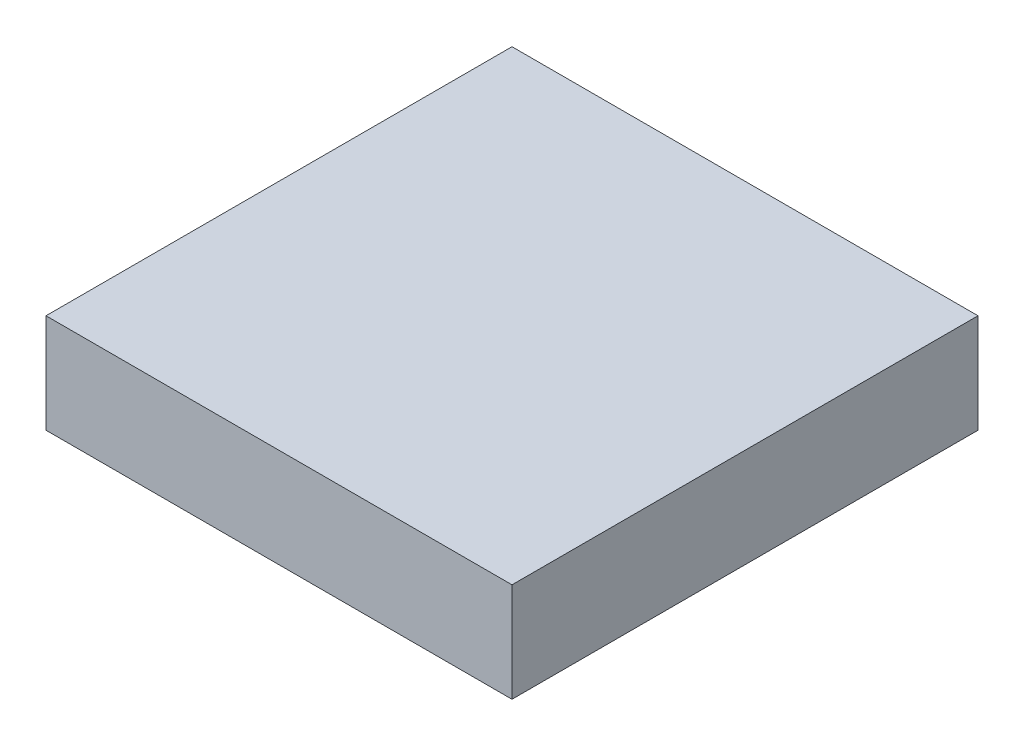
from build123d import *

# Parameters (mm, degrees)
SKETCH4_W           = 119.38
SKETCH4_H           = 119.38
BOSS_EXTRUDE2_DEPTH = 25.4


with BuildPart() as part:
    # Sketch4 → Boss-Extrude2 (new body)
    with BuildSketch(Plane(origin=(0, 0, 0), x_dir=(1, 0, 0), z_dir=(0, 1, 0))):
        with Locations((20.071603777, 42.236783626)):
            Rectangle(SKETCH4_W, SKETCH4_H)
    extrude(amount=BOSS_EXTRUDE2_DEPTH)


solid = part.part
